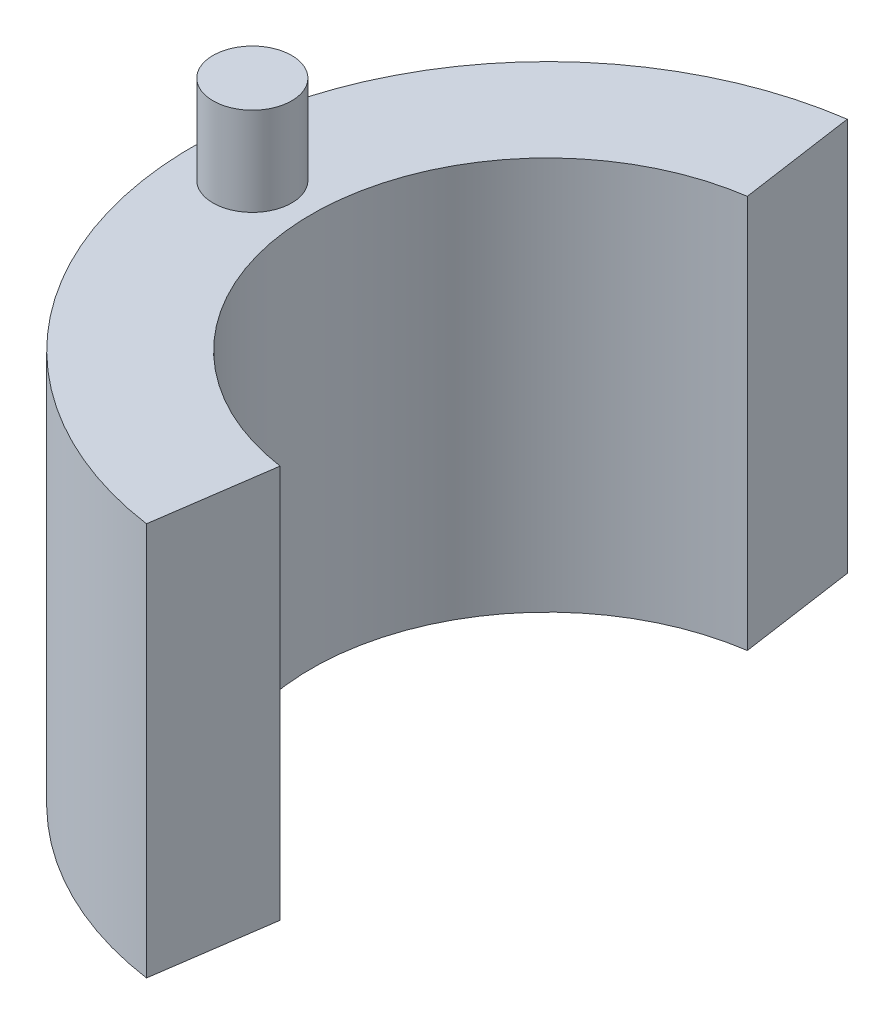
from build123d import *

# Parameters (mm, degrees)
BOSS_EXTRUDE1_DEPTH = 10
SKETCH2_R           = 1
BOSS_EXTRUDE2_DEPTH = 2.25


with BuildPart() as part:
    # Sketch1 → Boss-Extrude1 (new body)
    with BuildSketch(Plane(origin=(0, 0, 0), x_dir=(1, 0, 0), z_dir=(0, 1, 0))):
        with BuildLine():
            ThreePointArc((-0.855605783, -5.938681566), (-6, 0), (-0.855605783, 5.938681566))
            Line((-0.855605783, 5.938681566), (-1.283408674, 8.908022349))
            ThreePointArc((-1.283408674, 8.908022349), (-9, 0), (-1.283408674, -8.908022349))
            Line((-1.283408674, -8.908022349), (-0.855605783, -5.938681566))
        make_face()
    extrude(amount=BOSS_EXTRUDE1_DEPTH)

    # Sketch2 → Boss-Extrude2 (add)
    with BuildSketch(Plane(origin=(0, 10, 0), x_dir=(1, 0, 0), z_dir=(0, 1, 0))):
        with Locations(Location((-7.5, 0, 0), (0, 0, 270))):
            Circle(SKETCH2_R)
    extrude(amount=BOSS_EXTRUDE2_DEPTH)


solid = part.part
